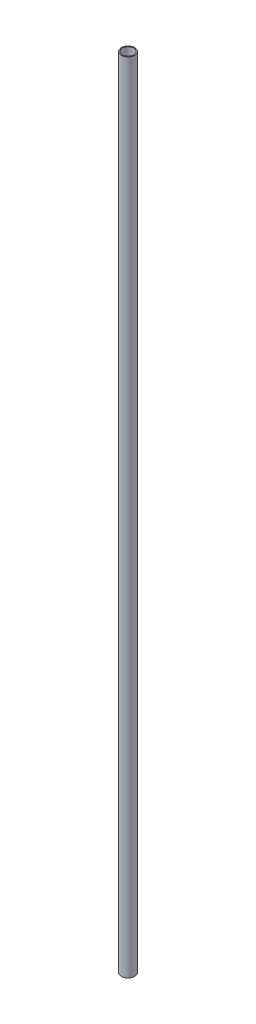
from build123d import *

# Parameters (mm, degrees)
SKETCH1_R           = 7.5
SKETCH1_R_2         = 6.5
BOSS_EXTRUDE1_DEPTH = 890


with BuildPart() as part:
    # Sketch1 → Boss-Extrude1 (new body)
    with BuildSketch(Plane(origin=(0, 0, 0), x_dir=(1, 0, 0), z_dir=(0, 1, 0))):
        with Locations(Location((0, 0, 0), (0, 0, 270))):
            Circle(SKETCH1_R)
        with Locations(Location((0, 0, 0), (0, 0, 270))):
            Circle(SKETCH1_R_2, mode=Mode.SUBTRACT)
    extrude(amount=-BOSS_EXTRUDE1_DEPTH)


solid = part.part
